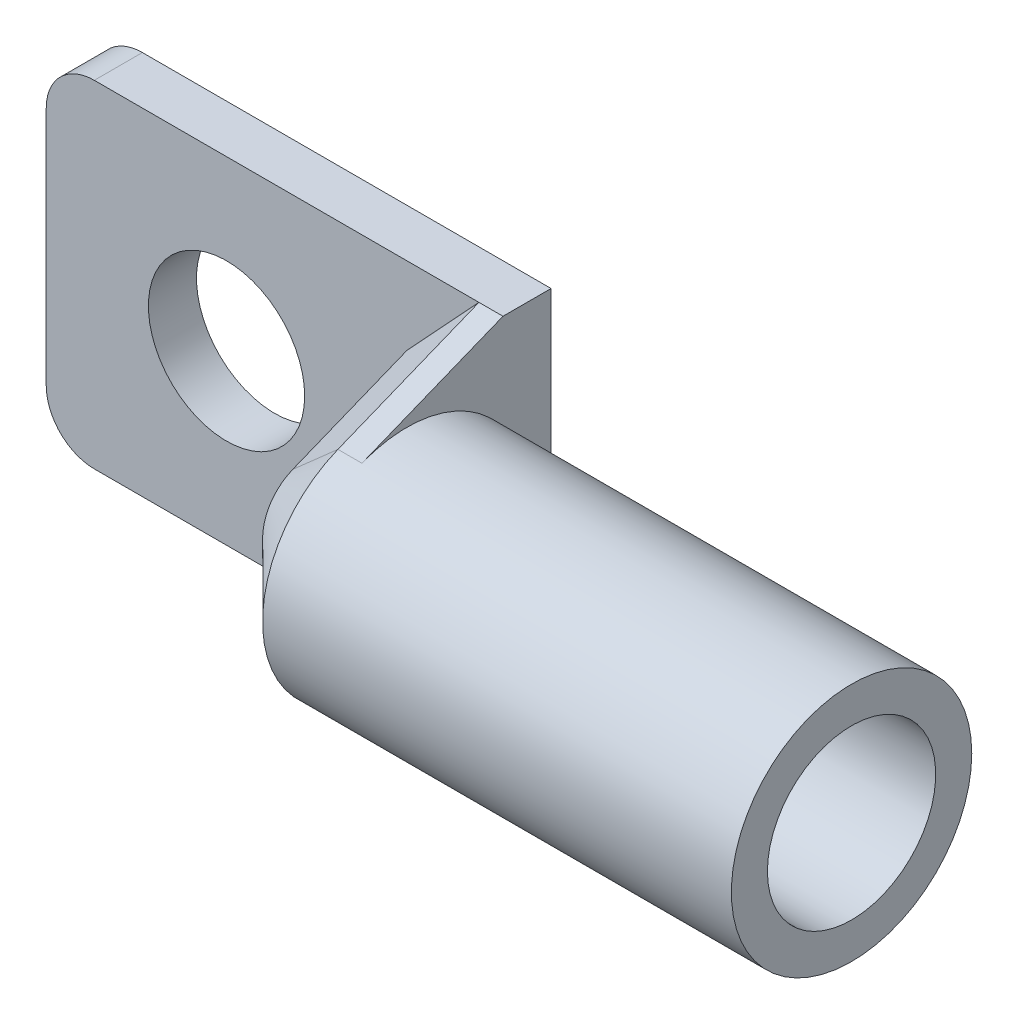
from build123d import *

# Parameters (mm, degrees)
SKETCH1_W           = 15
SKETCH1_H           = 14
SKETCH1_R           = 3.25
BOSS_EXTRUDE1_DEPTH = 2
SKETCH2_R           = 5
SKETCH2_R_2         = 3.5
BOSS_EXTRUDE2_DEPTH = 22.5
BOSS_EXTRUDE3_DEPTH = 4
CHAMFER1_SIZE       = 3
FILLET1_R           = 2


with BuildPart() as part:
    # Sketch1 → Boss-Extrude1 (new body)
    with BuildSketch(Plane.XY):
        Rectangle(SKETCH1_W, SKETCH1_H)
        Circle(SKETCH1_R, mode=Mode.SUBTRACT)
    extrude(amount=BOSS_EXTRUDE1_DEPTH)



with BuildPart() as body_2:
    # Sketch2 → Boss-Extrude2 (new body)
    with BuildSketch(Plane(origin=(7.5, 0, 0), x_dir=(0, 0, -1), z_dir=(1, 0, 0))):
        with Locations(Location((-6, 0, 0), (0, 0, 180))):
            Circle(SKETCH2_R)
        with Locations(Location((-6, 0, 0), (0, 0, 180))):
            Circle(SKETCH2_R_2, mode=Mode.SUBTRACT)
    extrude(amount=BOSS_EXTRUDE2_DEPTH)


with BuildPart() as part_1:
    add(part.part)

    add(body_2.part)  # Boss-Extrude3 merges body 2
    # Sketch3 → Boss-Extrude3 (add)
    with BuildSketch(Plane(origin=(7.5, 0, 0), x_dir=(0, 0, -1), z_dir=(1, 0, 0))):
        with BuildLine():
            Line((-7.867068249, 4.638324714), (-2, 7))
            Line((-2, 7), (0, 7))
            Line((0, 7), (0, -7))
            Line((0, -7), (-2, -7))
            Line((-2, -7), (-7.867068249, -4.638324714))
            ThreePointArc((-7.867068249, -4.638324714), (-11, 0), (-7.867068249, 4.638324714))
        make_face()
    extrude(amount=BOSS_EXTRUDE3_DEPTH)

    # Chamfer1
    chamfer1_edges = [part_1.edges().sort_by_distance(p)[0] for p in [
        (7.5, -2.798629911, 10.143388785),
        (7.5, -5.819162357, 4.933534125),
        (7.5, 5.819162357, 4.933534125),
    ]]
    chamfer(chamfer1_edges, length=CHAMFER1_SIZE)

    # Fillet1
    fillet1_edges = [part_1.edges().sort_by_distance(p)[0] for p in [
        (-7.5, 7, 1),
        (-7.5, -7, 1),
    ]]
    fillet(fillet1_edges, radius=FILLET1_R)


solid = part_1.part
